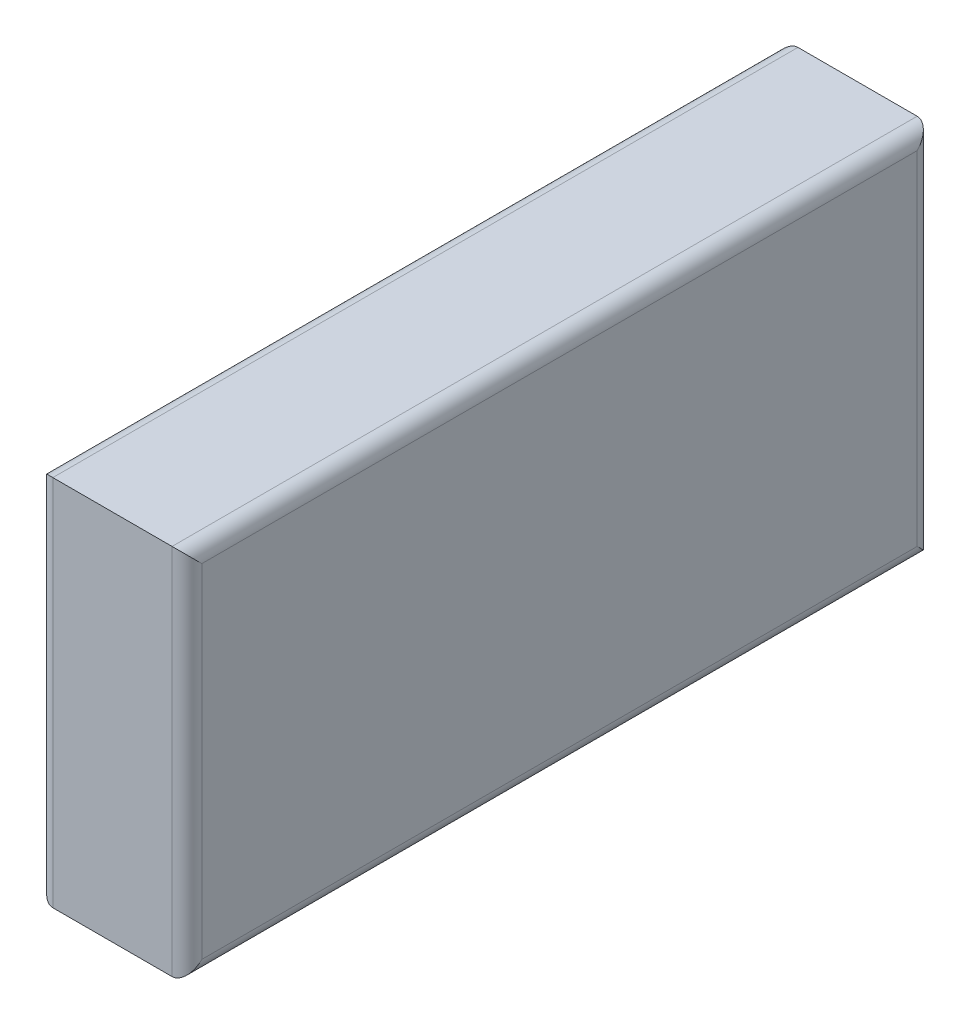
from build123d import *

# Parameters (mm, degrees)
CROQUIS1_W              = 20
CROQUIS1_H              = 50
SALIENTE_EXTRUIR1_DEPTH = 100
REDONDEO1_R             = 2


with BuildPart() as part:
    # Croquis1 → Saliente-Extruir1 (new body)
    with BuildSketch(Plane.XY):
        with Locations((-20.111803819, -16.907191939)):
            Rectangle(CROQUIS1_W, CROQUIS1_H)
    extrude(amount=SALIENTE_EXTRUIR1_DEPTH)

    # Redondeo1
    redondeo1_edges = [part.edges().sort_by_distance(p)[0] for p in [
        (-10.111803819, -16.907191939, 100),
        (-30.111803819, -16.907191939, 100),
        (-10.111803819, -16.907191939, 0),
        (-30.111803819, -16.907191939, 0),
        (-30.111803819, 8.092808061, 50),
        (-10.111803819, 8.092808061, 50),
        (-10.111803819, -41.907191939, 50),
        (-30.111803819, -41.907191939, 50),
    ]]
    fillet(redondeo1_edges, radius=REDONDEO1_R)


solid = part.part
